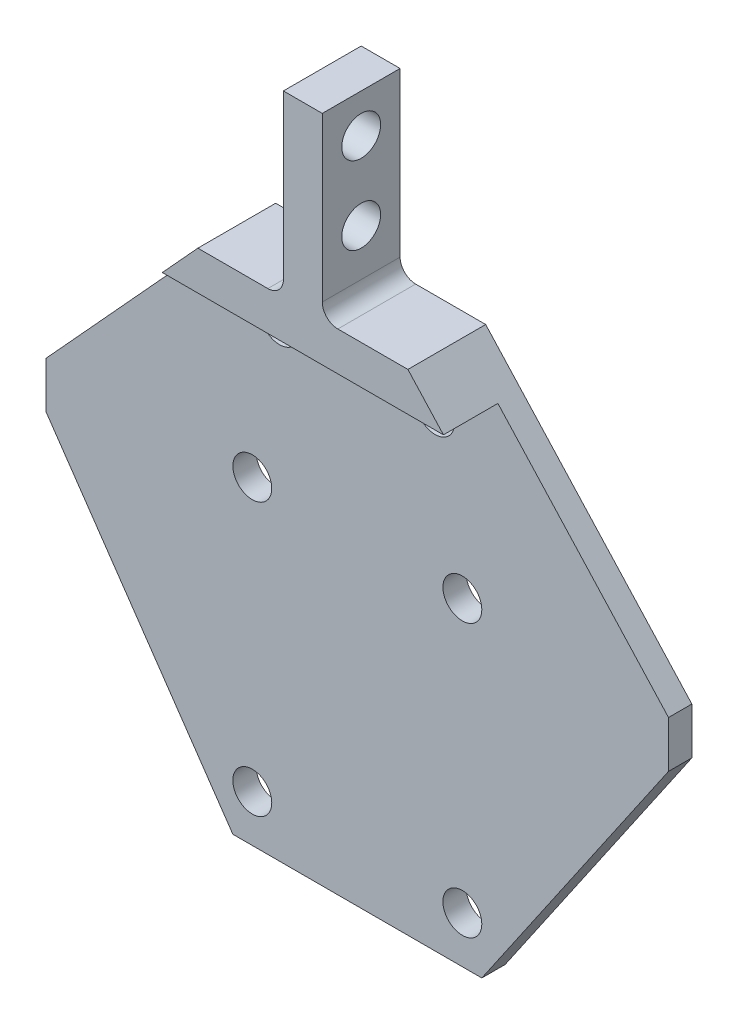
from build123d import *

# Parameters (mm, degrees)
SKETCH2_R                = 2.5
BOSS_EXTRUDE1_DEPTH      = 3
BOSS_EXTRUDE2_DEPTH      = 7
BOSS_EXTRUDE4_DEPTH      = 2.8
BOSS_EXTRUDE4_DEPTH_BACK = 2.2
SKETCH7_W                = 10
SKETCH7_H                = 23
SKETCH7_R                = 2.5
SKETCH9_R                = 2.5
CUT_EXTRUDE1_DEPTH       = 10
FILLET5_R                = 2


with BuildPart() as part:
    # Sketch2 → Boss-Extrude1 (new body)
    with BuildSketch(Plane.XY):
        Polygon((16, -41), (40, -6), (40, 0), (13.5, 29), (-13.5, 29), (-40, 0), (-40, -6), (-16, -41), align=None)
        with Locations((-13.5, 0)):
            Circle(SKETCH2_R, mode=Mode.SUBTRACT)
        with Locations((13.5, 0)):
            Circle(SKETCH2_R, mode=Mode.SUBTRACT)
        with Locations((13.5, -35)):
            Circle(SKETCH2_R, mode=Mode.SUBTRACT)
        with Locations((-13.5, -35)):
            Circle(SKETCH2_R, mode=Mode.SUBTRACT)
    extrude(amount=BOSS_EXTRUDE1_DEPTH)

    # Sketch4 → Boss-Extrude2 (add)
    with BuildSketch(Plane.XY.offset(3)):
        Polygon((-13.5, 29), (-18.068965517, 24), (18.068965517, 24), (13.5, 29), align=None)
    extrude(amount=BOSS_EXTRUDE2_DEPTH)

    # Sketch7 → Boss-Extrude4 (add, two sides: drawn at the far end of the back side and taken through both)
    with BuildSketch(Plane(origin=(-0.30437935, -56.168103165, -48.676228962), x_dir=(0, 0, -1), z_dir=(1, 0, 0)).offset(-BOSS_EXTRUDE4_DEPTH_BACK)):
        with Locations((-53.676228962, 96.668103165)):
            Rectangle(SKETCH7_W, SKETCH7_H)
        with Locations((-53.676228962, 103.168103165)):
            Circle(SKETCH7_R, mode=Mode.SUBTRACT)
        with Locations((-53.676228962, 93.168103165)):
            Circle(SKETCH7_R, mode=Mode.SUBTRACT)
    extrude(amount=BOSS_EXTRUDE4_DEPTH + BOSS_EXTRUDE4_DEPTH_BACK)

    # Sketch9 → Cut-Extrude1 (cut)
    with BuildSketch(Plane.XY.offset(3)):
        with Locations((-10, 19)):
            Circle(SKETCH9_R)
        with Locations((10, 19)):
            Circle(SKETCH9_R)
    extrude(amount=-CUT_EXTRUDE1_DEPTH, mode=Mode.SUBTRACT)

    # Fillet5
    fillet5_edges = [part.edges().sort_by_distance(p)[0] for p in [
        (-2.50437935, 29, 5),
        (2.49562065, 29, 5),
    ]]
    fillet(fillet5_edges, radius=FILLET5_R)


solid = part.part
